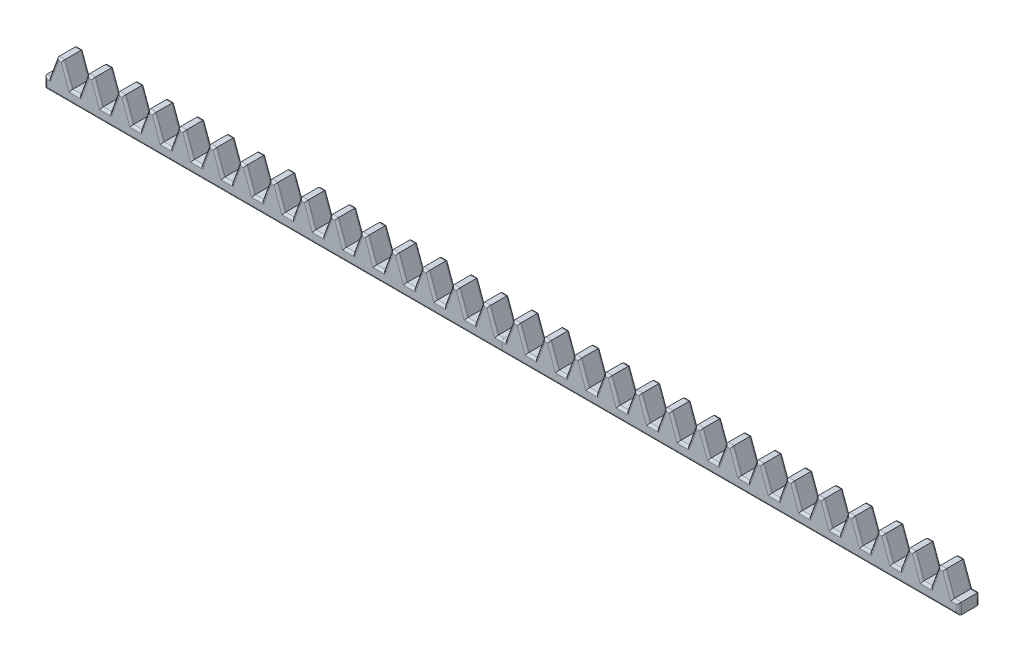
from build123d import *

# Parameters (mm, degrees)
BLANKSKE_W        = 400.000216
BLANKSKE_H        = 14.393333333
BLANK_DEPTH       = 8.89
TOOTHCUTSIM_DEPTH = 401.357806149
TEETHCUTS_COUNT   = 31
TEETHCUTS_PITCH   = 13.299408885
FILLET1_R         = 1


with BuildPart() as part:
    # BlankSke → Blank (new body)
    with BuildSketch(Plane.XY):
        with Locations((200.000108, 7.196666667)):
            Rectangle(BLANKSKE_W, BLANKSKE_H)
    extrude(amount=-BLANK_DEPTH)

    # TooCutSkeSim → ToothCutSim (cut, through all)
    with BuildSketch(Plane.XY):
        Polygon((1.909383065, 4.868333333), (-1.909383065, 4.868333333), (-5.38544439, 14.418733333), (5.38544439, 14.418733333), align=None)
    toothcutsim = extrude(amount=-TOOTHCUTSIM_DEPTH, mode=Mode.SUBTRACT)

    # TeethCuts: ToothCutSim ×31
    with Locations(*[(i * TEETHCUTS_PITCH, 0, 0) for i in range(1, TEETHCUTS_COUNT)]):
        add(toothcutsim, mode=Mode.SUBTRACT)

    # Fillet1
    fillet1_edges = [part.edges().sort_by_distance(p)[0] for p in [
        (400.000216, 2.434166667, -8.89),
        (59.847339982, 14.393333333, 0),
        (62.854253119, 9.630833333, 0),
        (59.847339983, 14.393333333, -8.89),
        (62.854253119, 9.630833333, -8.89),
        (70.139835731, 9.630833333, -8.89),
        (66.497044425, 4.868333333, -8.89),
        (70.139835731, 9.630833333, 0),
        (66.497044425, 4.868333333, 0),
        (73.146748867, 14.393333333, 0),
        (76.153662004, 9.630833333, 0),
        (73.146748867, 14.393333333, -8.89),
        (76.153662004, 9.630833333, -8.89),
        (83.439244616, 9.630833333, -8.89),
        (79.79645331, 4.868333333, -8.89),
        (83.439244616, 9.630833333, 0),
        (79.79645331, 4.868333333, 0),
        (0, 2.434166667, 0),
        (86.446157753, 14.393333333, 0),
        (0.954691532, 4.868333333, 0),
        (89.453070889, 9.630833333, 0),
        (86.446157753, 14.393333333, -8.89),
        (89.453070889, 9.630833333, -8.89),
        (96.738653501, 9.630833333, -8.89),
        (93.095862195, 4.868333333, -8.89),
        (96.738653501, 9.630833333, 0),
        (93.095862195, 4.868333333, 0),
        (0, 2.434166667, -8.89),
        (99.745566637, 14.393333333, 0),
        (102.752479774, 9.630833333, 0),
        (99.745566637, 14.393333333, -8.89),
        (102.752479774, 9.630833333, -8.89),
        (110.038062386, 9.630833333, -8.89),
        (106.39527108, 4.868333333, -8.89),
        (110.038062386, 9.630833333, 0),
        (106.39527108, 4.868333333, 0),
        (113.044975523, 14.393333333, 0),
        (116.051888659, 9.630833333, 0),
        (113.044975523, 14.393333333, -8.89),
        (116.051888659, 9.630833333, -8.89),
        (123.337471271, 9.630833333, -8.89),
        (119.694679965, 4.868333333, -8.89),
        (123.337471271, 9.630833333, 0),
        (119.694679965, 4.868333333, 0),
        (126.344384408, 14.393333333, 0),
        (129.351297544, 9.630833333, 0),
        (126.344384408, 14.393333333, -8.89),
        (129.351297544, 9.630833333, -8.89),
        (136.636880156, 9.630833333, -8.89),
        (132.99408885, 4.868333333, -8.89),
        (136.636880156, 9.630833333, 0),
        (132.99408885, 4.868333333, 0),
        (3.642791306, 9.630833333, -8.89),
        (0.954691532, 4.868333333, -8.89),
        (139.643793292, 14.393333333, 0),
        (142.650706429, 9.630833333, 0),
        (139.643793292, 14.393333333, -8.89),
        (3.642791306, 9.630833333, 0),
        (142.650706429, 9.630833333, -8.89),
        (149.936289041, 9.630833333, -8.89),
        (146.293497735, 4.868333333, -8.89),
        (149.936289041, 9.630833333, 0),
        (146.293497735, 4.868333333, 0),
        (152.943202177, 14.393333333, 0),
        (155.950115314, 9.630833333, 0),
        (152.943202177, 14.393333333, -8.89),
        (155.950115314, 9.630833333, -8.89),
        (163.235697926, 9.630833333, -8.89),
        (159.59290662, 4.868333333, -8.89),
        (163.235697926, 9.630833333, 0),
        (159.59290662, 4.868333333, 0),
        (166.242611062, 14.393333333, 0),
        (169.249524199, 9.630833333, 0),
        (166.242611062, 14.393333333, -8.89),
        (169.249524199, 9.630833333, -8.89),
        (176.535106811, 9.630833333, -8.89),
        (172.892315505, 4.868333333, -8.89),
        (176.535106811, 9.630833333, 0),
        (172.892315505, 4.868333333, 0),
        (179.542019947, 14.393333333, 0),
        (182.548933084, 9.630833333, 0),
        (179.542019947, 14.393333333, -8.89),
        (182.548933084, 9.630833333, -8.89),
        (189.834515696, 9.630833333, -8.89),
        (186.19172439, 4.868333333, -8.89),
        (189.834515696, 9.630833333, 0),
        (186.19172439, 4.868333333, 0),
        (192.841428832, 14.393333333, 0),
        (195.848341969, 9.630833333, 0),
        (192.841428833, 14.393333333, -8.89),
        (195.848341969, 9.630833333, -8.89),
        (203.133924581, 9.630833333, -8.89),
        (199.491133275, 4.868333333, -8.89),
        (203.133924581, 9.630833333, 0),
        (199.491133275, 4.868333333, 0),
        (206.140837718, 14.393333333, 0),
        (209.147750854, 9.630833333, 0),
        (206.140837718, 14.393333333, -8.89),
        (209.147750854, 9.630833333, -8.89),
        (216.433333466, 9.630833333, -8.89),
        (212.79054216, 4.868333333, -8.89),
        (216.433333466, 9.630833333, 0),
        (212.79054216, 4.868333333, 0),
        (219.440246602, 14.393333333, 0),
        (222.447159739, 9.630833333, 0),
        (219.440246602, 14.393333333, -8.89),
        (6.649704442, 14.393333333, 0),
        (222.447159739, 9.630833333, -8.89),
        (229.732742351, 9.630833333, -8.89),
        (226.089951045, 4.868333333, -8.89),
        (229.732742351, 9.630833333, 0),
        (226.089951045, 4.868333333, 0),
        (9.656617579, 9.630833333, 0),
        (232.739655487, 14.393333333, 0),
        (235.746568624, 9.630833333, 0),
        (232.739655487, 14.393333333, -8.89),
        (235.746568624, 9.630833333, -8.89),
        (6.649704442, 14.393333333, -8.89),
        (243.032151236, 9.630833333, -8.89),
        (239.38935993, 4.868333333, -8.89),
        (243.032151236, 9.630833333, 0),
        (239.38935993, 4.868333333, 0),
        (246.039064372, 14.393333333, 0),
        (249.045977509, 9.630833333, 0),
        (246.039064372, 14.393333333, -8.89),
        (249.045977509, 9.630833333, -8.89),
        (256.331560121, 9.630833333, -8.89),
        (252.688768815, 4.868333333, -8.89),
        (256.331560121, 9.630833333, 0),
        (252.688768815, 4.868333333, 0),
        (259.338473258, 14.393333333, 0),
        (262.345386394, 9.630833333, 0),
        (259.338473258, 14.393333333, -8.89),
        (262.345386394, 9.630833333, -8.89),
        (269.630969006, 9.630833333, -8.89),
        (265.9881777, 4.868333333, -8.89),
        (269.630969006, 9.630833333, 0),
        (265.9881777, 4.868333333, 0),
        (9.656617579, 9.630833333, -8.89),
        (272.637882142, 14.393333333, 0),
        (275.644795279, 9.630833333, 0),
        (272.637882142, 14.393333333, -8.89),
        (16.942200191, 9.630833333, -8.89),
        (275.644795279, 9.630833333, -8.89),
        (282.930377891, 9.630833333, -8.89),
        (13.299408885, 4.868333333, -8.89),
        (279.287586585, 4.868333333, -8.89),
        (282.930377891, 9.630833333, 0),
        (279.287586585, 4.868333333, 0),
        (16.942200191, 9.630833333, 0),
        (285.937291028, 14.393333333, 0),
        (13.299408885, 4.868333333, 0),
        (288.944204164, 9.630833333, 0),
        (285.937291028, 14.393333333, -8.89),
        (288.944204164, 9.630833333, -8.89),
        (296.229786776, 9.630833333, -8.89),
        (292.58699547, 4.868333333, -8.89),
        (296.229786776, 9.630833333, 0),
        (292.58699547, 4.868333333, 0),
        (299.236699913, 14.393333333, 0),
        (302.243613049, 9.630833333, 0),
        (299.236699913, 14.393333333, -8.89),
        (302.243613049, 9.630833333, -8.89),
        (309.529195661, 9.630833333, -8.89),
        (305.886404355, 4.868333333, -8.89),
        (309.529195661, 9.630833333, 0),
        (305.886404355, 4.868333333, 0),
        (312.536108797, 14.393333333, 0),
        (315.543021934, 9.630833333, 0),
        (312.536108797, 14.393333333, -8.89),
        (315.543021934, 9.630833333, -8.89),
        (322.828604546, 9.630833333, -8.89),
        (319.18581324, 4.868333333, -8.89),
        (322.828604546, 9.630833333, 0),
        (319.18581324, 4.868333333, 0),
        (325.835517683, 14.393333333, 0),
        (328.842430819, 9.630833333, 0),
        (325.835517683, 14.393333333, -8.89),
        (328.842430819, 9.630833333, -8.89),
        (336.128013431, 9.630833333, -8.89),
        (332.485222125, 4.868333333, -8.89),
        (336.128013431, 9.630833333, 0),
        (332.485222125, 4.868333333, 0),
        (339.134926567, 14.393333333, 0),
        (342.141839704, 9.630833333, 0),
        (339.134926567, 14.393333333, -8.89),
        (400.000216, 2.434166667, 0),
        (342.141839704, 9.630833333, -8.89),
        (349.427422316, 9.630833333, -8.89),
        (345.78463101, 4.868333333, -8.89),
        (349.427422316, 9.630833333, 0),
        (345.78463101, 4.868333333, 0),
        (352.434335453, 14.393333333, 0),
        (355.441248589, 9.630833333, 0),
        (352.434335453, 14.393333333, -8.89),
        (19.949113328, 14.393333333, 0),
        (355.441248589, 9.630833333, -8.89),
        (362.726831201, 9.630833333, -8.89),
        (359.084039895, 4.868333333, -8.89),
        (362.726831201, 9.630833333, 0),
        (359.084039895, 4.868333333, 0),
        (22.956026464, 9.630833333, 0),
        (365.733744337, 14.393333333, 0),
        (368.740657474, 9.630833333, 0),
        (365.733744337, 14.393333333, -8.89),
        (368.740657474, 9.630833333, -8.89),
        (19.949113328, 14.393333333, -8.89),
        (376.026240086, 9.630833333, -8.89),
        (372.38344878, 4.868333333, -8.89),
        (376.026240086, 9.630833333, 0),
        (200.000108, 0, 0),
        (372.38344878, 4.868333333, 0),
        (379.033153223, 14.393333333, 0),
        (382.040066359, 9.630833333, 0),
        (379.033153223, 14.393333333, -8.89),
        (382.040066359, 9.630833333, -8.89),
        (389.325648971, 9.630833333, -8.89),
        (385.682857665, 4.868333333, -8.89),
        (389.325648971, 9.630833333, 0),
        (385.682857665, 4.868333333, 0),
        (392.332562108, 14.393333333, 0),
        (395.339475244, 9.630833333, 0),
        (392.332562107, 14.393333333, -8.89),
        (395.339475244, 9.630833333, -8.89),
        (398.536549743, 4.868333333, -8.89),
        (398.536549743, 4.868333333, 0),
        (22.956026464, 9.630833333, -8.89),
        (30.241609076, 9.630833333, -8.89),
        (26.59881777, 4.868333333, -8.89),
        (30.241609076, 9.630833333, 0),
        (26.59881777, 4.868333333, 0),
        (33.248522213, 14.393333333, 0),
        (200.000108, 0, -8.89),
        (36.255435349, 9.630833333, 0),
        (33.248522213, 14.393333333, -8.89),
        (36.255435349, 9.630833333, -8.89),
        (43.541017961, 9.630833333, -8.89),
        (39.898226655, 4.868333333, -8.89),
        (43.541017961, 9.630833333, 0),
        (39.898226655, 4.868333333, 0),
        (46.547931097, 14.393333333, 0),
        (49.554844234, 9.630833333, 0),
        (46.547931097, 14.393333333, -8.89),
        (49.554844234, 9.630833333, -8.89),
        (56.840426846, 9.630833333, -8.89),
        (53.19763554, 4.868333333, -8.89),
        (56.840426846, 9.630833333, 0),
        (53.19763554, 4.868333333, 0),
    ]]
    fillet(fillet1_edges, radius=FILLET1_R)


with BuildPart() as body_2:
    # Split1: the piece on the far side of the plane
    add(part.part)
    split(bisect_by=Plane(origin=(200.000108, 0, 0), x_dir=(0, 0, -1), z_dir=(-1, 0, 0)), keep=Keep.BOTTOM)


with BuildPart() as part_1:
    add(part.part)

    # Split1
    split(bisect_by=Plane(origin=(200.000108, 0, 0), x_dir=(0, 0, -1), z_dir=(-1, 0, 0)), keep=Keep.TOP)


solid = Compound([body_2.part, part_1.part])
